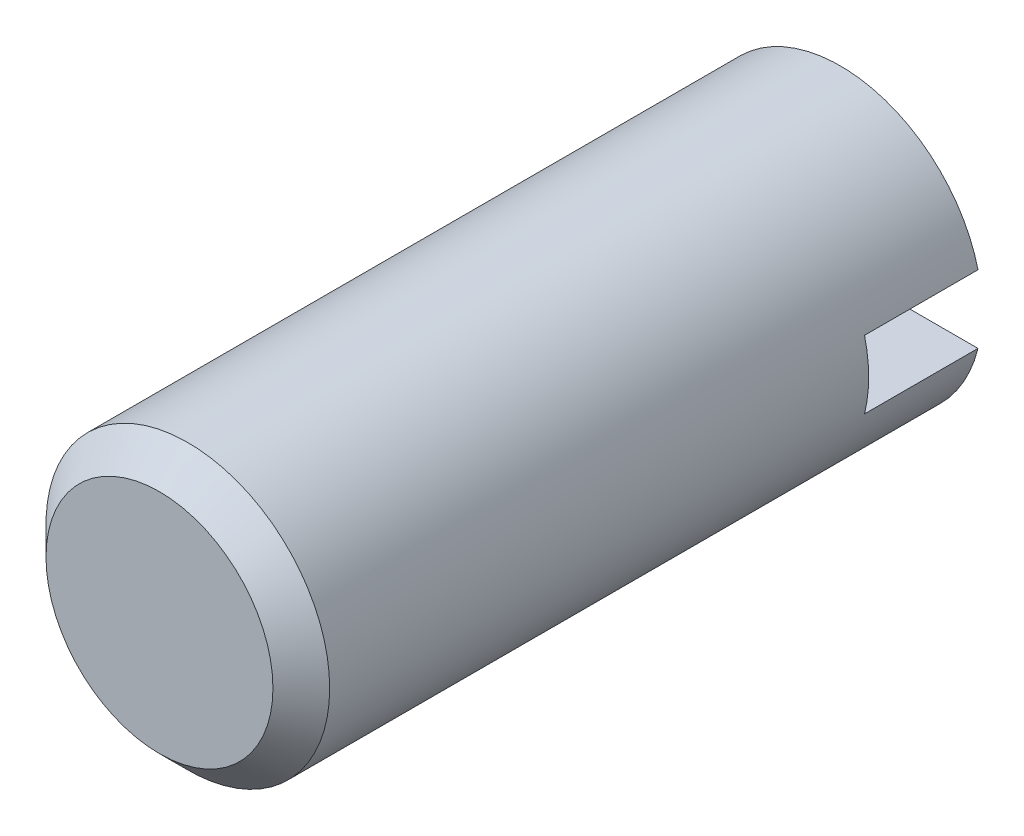
from build123d import *

# Parameters (mm, degrees)
SKETCH2_W          = 5.424806346
SKETCH2_H          = 1.2
CUT_EXTRUDE1_DEPTH = 2


with BuildPart() as part:
    # Sketch1 → Revolve1 (revolve)
    with BuildSketch(Plane(origin=(0, 0, 0), x_dir=(0, 0, -1), z_dir=(1, 0, 0)), mode=Mode.PRIVATE) as revolve1_sk:
        Polygon((0, 0), (0, 2), (0.5, 2.5), (12, 2.5), (12, 0), align=None)
    revolve(revolve1_sk.sketch.rotate(Axis((0, 0, 0), (0, 0, -1)), 90), axis=Axis((0, 0, 0), (0, 0, -1)))

    # Sketch2 → Cut-Extrude1 (cut)
    with BuildSketch(Plane(origin=(0, 0, -12), x_dir=(-1, 0, 0), z_dir=(0, 0, -1))):
        Rectangle(SKETCH2_W, SKETCH2_H)
    extrude(amount=-CUT_EXTRUDE1_DEPTH, mode=Mode.SUBTRACT)


solid = part.part
